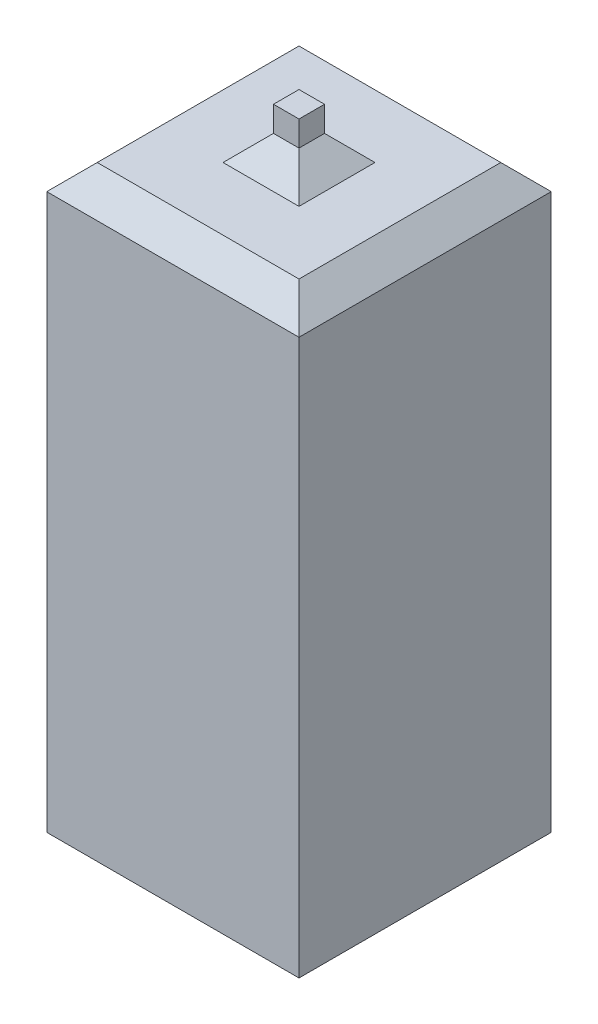
from build123d import *

# Parameters (mm, degrees)
SKETCH1_W           = 500
SKETCH1_H           = 500
BOSS_EXTRUDE1_DEPTH = 1200
SKETCH2_W           = 50.59676849
SKETCH2_H           = 50.59676849
BOSS_EXTRUDE2_DEPTH = 100
CHAMFER1_SIZE       = 50


with BuildPart() as part:
    # Sketch1 → Boss-Extrude1 (new body)
    with BuildSketch(Plane(origin=(0, 0, 0), x_dir=(1, 0, 0), z_dir=(0, 1, 0))):
        Rectangle(SKETCH1_W, SKETCH1_H)
    extrude(amount=BOSS_EXTRUDE1_DEPTH)

    # Sketch2 → Boss-Extrude2 (add)
    with BuildSketch(Plane(origin=(0, 1200, 0), x_dir=(1, 0, 0), z_dir=(0, 1, 0))):
        Rectangle(SKETCH2_W, SKETCH2_H)
    extrude(amount=BOSS_EXTRUDE2_DEPTH)

    # Chamfer1
    chamfer1_edges = [part.edges().sort_by_distance(p)[0] for p in [
        (-250, 1200, 0),
        (25.298384245, 1200, 0),
        (0, 1200, -25.298384245),
        (-25.298384245, 1200, 0),
        (0, 1200, 250),
        (0, 1200, 25.298384245),
        (250, 1200, 0),
        (0, 0, 250),
        (-250, 0, 0),
        (0, 0, -250),
        (250, 0, 0),
        (0, 1200, -250),
    ]]
    chamfer(chamfer1_edges, length=CHAMFER1_SIZE)


solid = part.part
